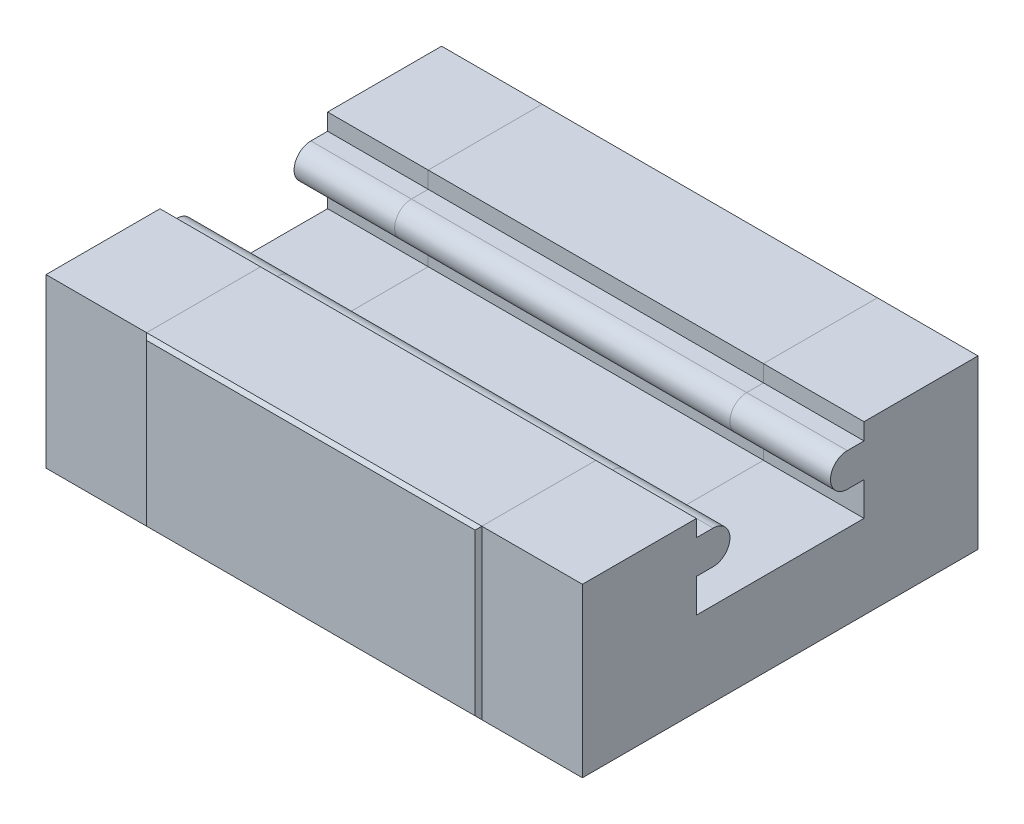
from build123d import *

# Parameters (mm, degrees)
BOSS_EXTRUDE1_DEPTH = 12.7
FILLET1_RADIUS      = 0.635
FILLET1_LENGTH      = 12.7
FILLET2_RADIUS      = 0.635
FILLET2_LENGTH      = 12.7
CHAMFER1_SIZE       = 0.127
BOSS_EXTRUDE2_DEPTH = 3.81
BOSS_EXTRUDE3_DEPTH = 3.81


with BuildPart() as part:
    # Sketch1 → Boss-Extrude1 (new body)
    with BuildSketch(Plane(origin=(0, 0, 0), x_dir=(0, 0, -1), z_dir=(1, 0, 0))):
        Polygon((-7.62, -3.175), (7.62, -3.175), (7.62, 3.175), (3.175, 3.175), (3.175, 2.543), (1.905, 2.543), (1.905, 1.273), (3.175, 1.273), (3.175, 0.003), (-3.175, 0.003), (-3.175, 1.273), (-1.905, 1.273), (-1.905, 2.543), (-3.175, 2.543), (-3.175, 3.175), (-7.62, 3.175), align=None)
    extrude(amount=BOSS_EXTRUDE1_DEPTH)

    # Fillet1: full round fillet: the end face becomes a half cylinder, R = half its width
    fillet1_face = Plane((6.35, 1.908, -1.905), x_dir=(1, 0, 0), z_dir=(0, 0, 1))  # on the end face: x along it, z out of the body
    fillet1_slab = fillet1_face.offset(-FILLET1_RADIUS / 2) * Box(FILLET1_LENGTH, 2 * FILLET1_RADIUS, FILLET1_RADIUS, mode=Mode.PRIVATE)  # the body's end, R deep
    fillet1_round = Plane((6.35, 1.908, -2.54), x_dir=(0, 0, 1), z_dir=(1, 0, 0)) * Cylinder(FILLET1_RADIUS, FILLET1_LENGTH, mode=Mode.PRIVATE)  # its axis R under the face
    add(fillet1_slab - fillet1_round, mode=Mode.SUBTRACT)

    # Fillet2: full round fillet: the end face becomes a half cylinder, R = half its width
    fillet2_face = Plane((6.35, 1.908, 1.905), x_dir=(1, 0, 0), z_dir=(0, 0, -1))  # on the end face: x along it, z out of the body
    fillet2_slab = fillet2_face.offset(-FILLET2_RADIUS / 2) * Box(FILLET2_LENGTH, 2 * FILLET2_RADIUS, FILLET2_RADIUS, mode=Mode.PRIVATE)  # the body's end, R deep
    fillet2_round = Plane((6.35, 1.908, 2.54), x_dir=(0, 0, -1), z_dir=(1, 0, 0)) * Cylinder(FILLET2_RADIUS, FILLET2_LENGTH, mode=Mode.PRIVATE)  # its axis R under the face
    add(fillet2_slab - fillet2_round, mode=Mode.SUBTRACT)

    # Chamfer1
    chamfer1_edges = [part.edges().sort_by_distance(p)[0] for p in [
        (0, 0, -7.62),
        (0, 0, 7.62),
        (6.35, 3.175, -7.62),
        (6.35, -3.175, -7.62),
        (6.35, -3.175, 7.62),
        (6.35, 3.175, 7.62),
        (12.7, 0, 7.62),
        (12.7, 0, -7.62),
    ]]
    chamfer(chamfer1_edges, length=CHAMFER1_SIZE)


with BuildPart() as body_2:
    # Sketch2 → Boss-Extrude2 (new body)
    with BuildSketch(Plane(origin=(12.7, 0, 0), x_dir=(0, 0, -1), z_dir=(1, 0, 0))):
        with BuildLine():
            Line((-7.493, -3.175), (7.493, -3.175))
            Line((7.493, -3.175), (7.493, 3.175))
            Line((7.493, 3.175), (3.175, 3.175))
            Line((3.175, 3.175), (3.175, 2.543))
            Line((3.175, 2.543), (2.54, 2.543))
            ThreePointArc((2.54, 2.543), (1.905, 1.908), (2.54, 1.273))
            Line((2.54, 1.273), (3.175, 1.273))
            Line((3.175, 1.273), (3.175, 0.003))
            Line((3.175, 0.003), (-3.175, 0.003))
            Line((-3.175, 0.003), (-3.175, 1.273))
            Line((-3.175, 1.273), (-2.54, 1.273))
            ThreePointArc((-2.54, 1.273), (-1.905, 1.908), (-2.54, 2.543))
            Line((-2.54, 2.543), (-3.175, 2.543))
            Line((-3.175, 2.543), (-3.175, 3.175))
            Line((-3.175, 3.175), (-7.493, 3.175))
            Line((-7.493, 3.175), (-7.493, -3.175))
        make_face()
    extrude(amount=BOSS_EXTRUDE2_DEPTH)


with BuildPart() as body_3:
    # Sketch3 → Boss-Extrude3 (new body)
    with BuildSketch(Plane.ZY):
        with BuildLine():
            Line((-3.175, 3.175), (-7.493, 3.175))
            Line((-7.493, 3.175), (-7.493, -3.175))
            Line((-7.493, -3.175), (7.493, -3.175))
            Line((7.493, -3.175), (7.493, 3.175))
            Line((7.493, 3.175), (3.175, 3.175))
            Line((3.175, 3.175), (3.175, 2.543))
            Line((3.175, 2.543), (2.54, 2.543))
            ThreePointArc((2.54, 2.543), (1.905, 1.908), (2.54, 1.273))
            Line((2.54, 1.273), (3.175, 1.273))
            Line((3.175, 1.273), (3.175, 0.003))
            Line((3.175, 0.003), (-3.175, 0.003))
            Line((-3.175, 0.003), (-3.175, 1.273))
            Line((-3.175, 1.273), (-2.54, 1.273))
            ThreePointArc((-2.54, 1.273), (-1.905, 1.908), (-2.54, 2.543))
            Line((-2.54, 2.543), (-3.175, 2.543))
            Line((-3.175, 2.543), (-3.175, 3.175))
        make_face()
    extrude(amount=BOSS_EXTRUDE3_DEPTH)


solid = Compound([part.part, body_2.part, body_3.part])
